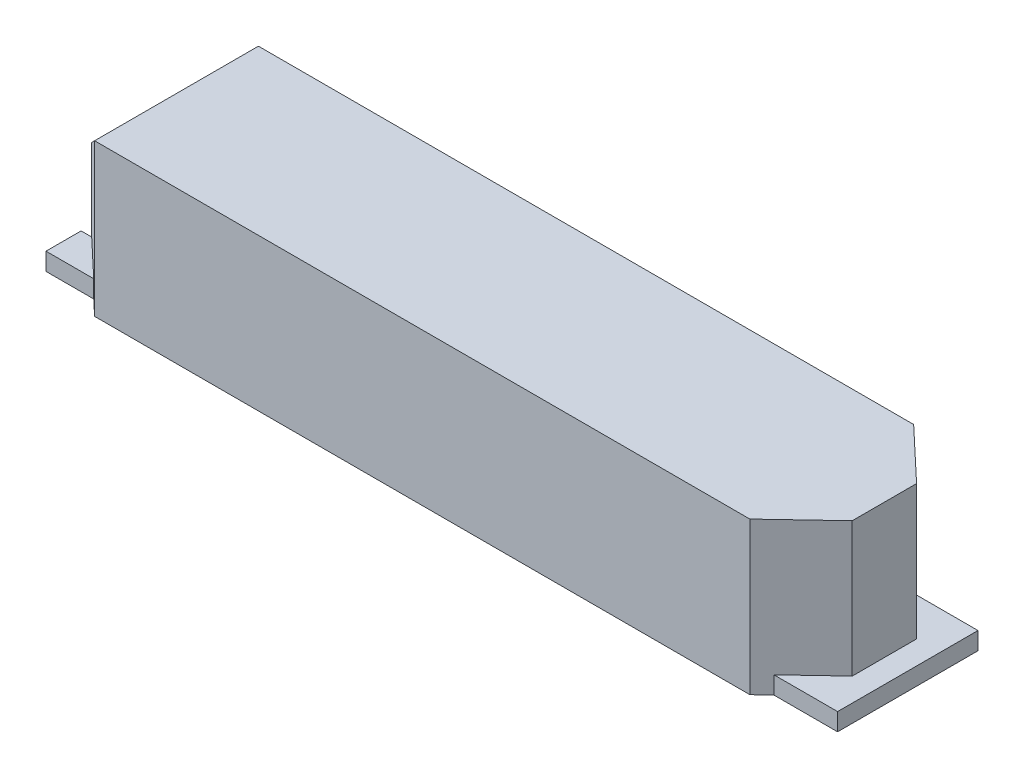
from build123d import *

# Parameters (mm, degrees)
BOSS_EXTRUDE1_DEPTH = 1.3
CUT_EXTRUDE1_DEPTH  = 4.769946949
SKETCH4_W           = 0.6
SKETCH4_H           = 1.2
SKETCH4_W_2         = 0.55
SKETCH4_H_2         = 0.3
BOSS_EXTRUDE2_DEPTH = 0.15


with BuildPart() as part:
    # Sketch1 → Boss-Extrude1 (new body)
    with BuildSketch(Plane(origin=(0, 0, 0), x_dir=(1, 0, 0), z_dir=(0, 1, 0))):
        Polygon((2.8, -0.7), (-2.8, -0.7), (-3.25, -0.275), (-3.25, 0.275), (-2.8, 0.7), (2.8, 0.7), (3.25, 0.275), (3.25, -0.275), align=None)
    extrude(amount=BOSS_EXTRUDE1_DEPTH)

    # Sketch2 → Cut-Extrude1 (cut, through all)
    with BuildSketch(Plane.XY.offset(0.7)):
        Polygon((-2.8, 1.3), (-3.25, 0.85), (-3.487156898, 1.338767614), align=None)
    extrude(amount=-CUT_EXTRUDE1_DEPTH, mode=Mode.SUBTRACT)

    # Sketch4 → Boss-Extrude2 (add)
    with BuildSketch(Plane.XZ):
        with Locations((3.15, 0)):
            Rectangle(SKETCH4_W, SKETCH4_H)
        with Locations((-3.065339152, 0.425)):
            Rectangle(SKETCH4_W_2, SKETCH4_H_2)
        with Locations((-3.065339152, -0.425)):
            Rectangle(SKETCH4_W_2, SKETCH4_H_2)
    extrude(amount=-BOSS_EXTRUDE2_DEPTH)


solid = part.part
